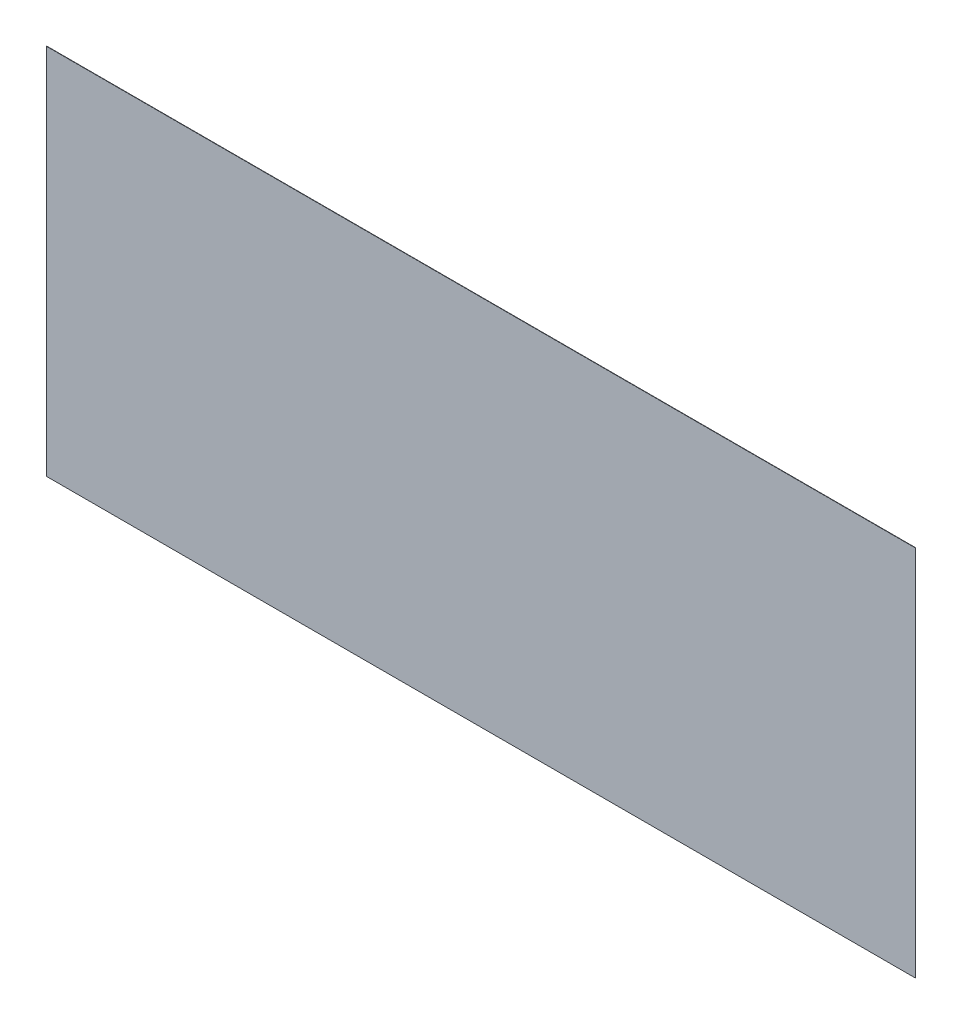
from build123d import *

# Parameters (mm, degrees)
SKETCH1_W           = 2100
SKETCH1_H           = 900
BOSS_EXTRUDE1_DEPTH = 0.9
SHELL1_T            = -0.35


with BuildPart() as part:
    # Sketch1 → Boss-Extrude1 (new body)
    with BuildSketch(Plane.XY):
        Rectangle(SKETCH1_W, SKETCH1_H)
    extrude(amount=BOSS_EXTRUDE1_DEPTH)

    # Shell1
    shell1_openings = [part.faces().sort_by_distance(p)[0] for p in [
        (0, 450, 0.45),
    ]]
    offset(amount=SHELL1_T, openings=shell1_openings, kind=Kind.INTERSECTION)


solid = part.part
